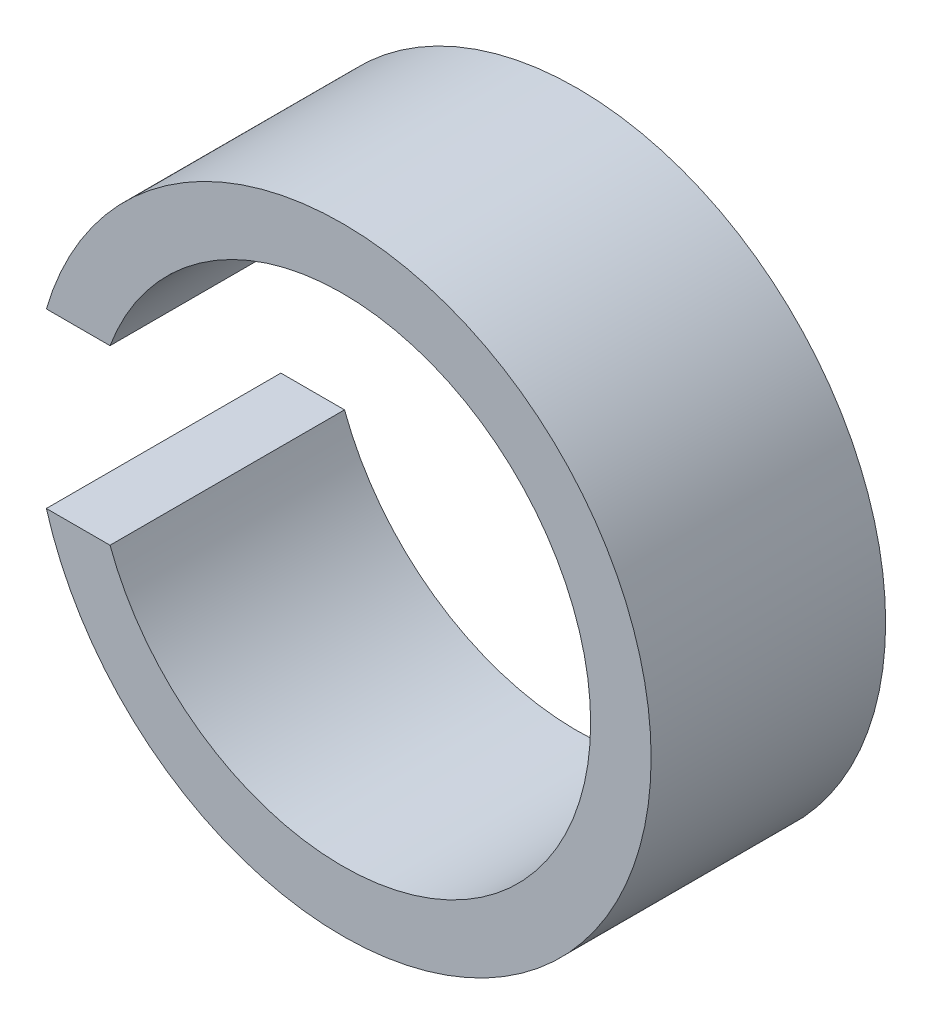
from build123d import *

# Parameters (mm, degrees)
SKETCH_1_R          = 25
SKETCH_1_R_2        = 20.1
EXTRUDE_1_DEPTH     = 19
SKETCH_2_W          = 78.996684193
SKETCH_2_H          = 55.130784999
CUT_EXTRUDE_1_DEPTH = 7


with BuildPart() as part:
    # 草图1 → 凸台-拉伸1 (new body)
    with BuildSketch(Plane.XY):
        Circle(SKETCH_1_R)
        Circle(SKETCH_1_R_2, mode=Mode.SUBTRACT)
    extrude(amount=EXTRUDE_1_DEPTH)

    # 草图2 → 切除-拉伸1 (cut, symmetric)
    with BuildSketch(Plane(origin=(0, 0, 0), x_dir=(1, 0, 0), z_dir=(0, 1, 0))):
        with Locations((-43.954307374, -15.257405538)):
            Rectangle(SKETCH_2_W, SKETCH_2_H)
    extrude(amount=CUT_EXTRUDE_1_DEPTH, both=True, mode=Mode.SUBTRACT)


solid = part.part
